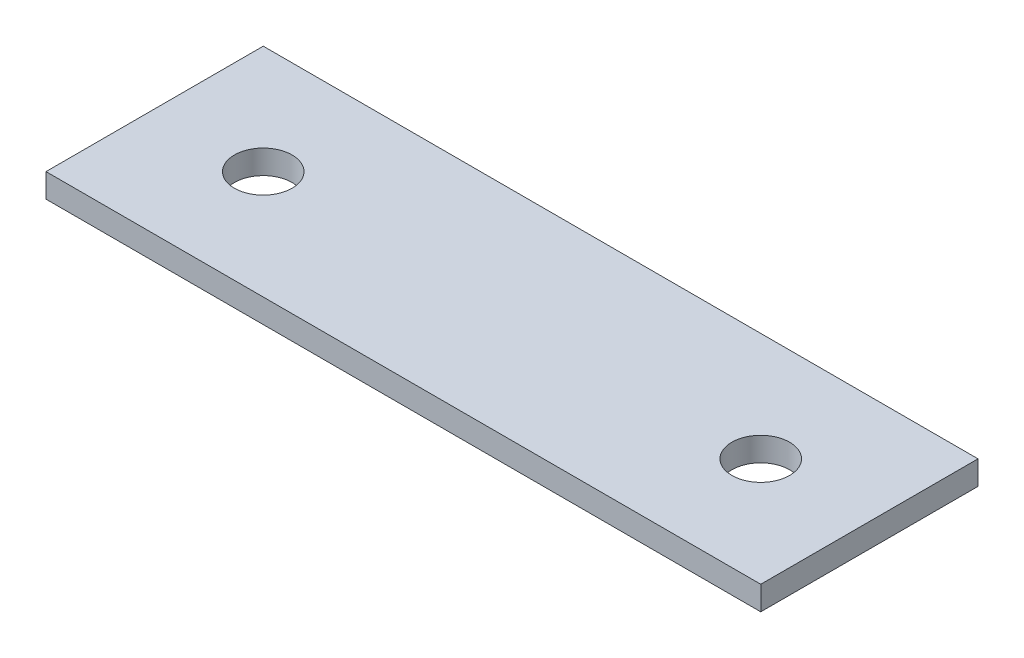
from build123d import *

# Parameters (mm, degrees)
SKETCH1_W           = 83.566
SKETCH1_H           = 25.4
SKETCH1_R           = 3.3734375
BOSS_EXTRUDE1_DEPTH = 2.794


with BuildPart() as part:
    # Sketch1 → Boss-Extrude1 (new body)
    with BuildSketch(Plane(origin=(0, 0, 0), x_dir=(1, 0, 0), z_dir=(0, 1, 0))):
        Rectangle(SKETCH1_W, SKETCH1_H)
        with Locations(Location((-29.083, 0, 0), (0, 0, 270))):
            Circle(SKETCH1_R, mode=Mode.SUBTRACT)
        with Locations(Location((29.083, 0, 0), (0, 0, 270))):
            Circle(SKETCH1_R, mode=Mode.SUBTRACT)
    extrude(amount=BOSS_EXTRUDE1_DEPTH)


solid = part.part
